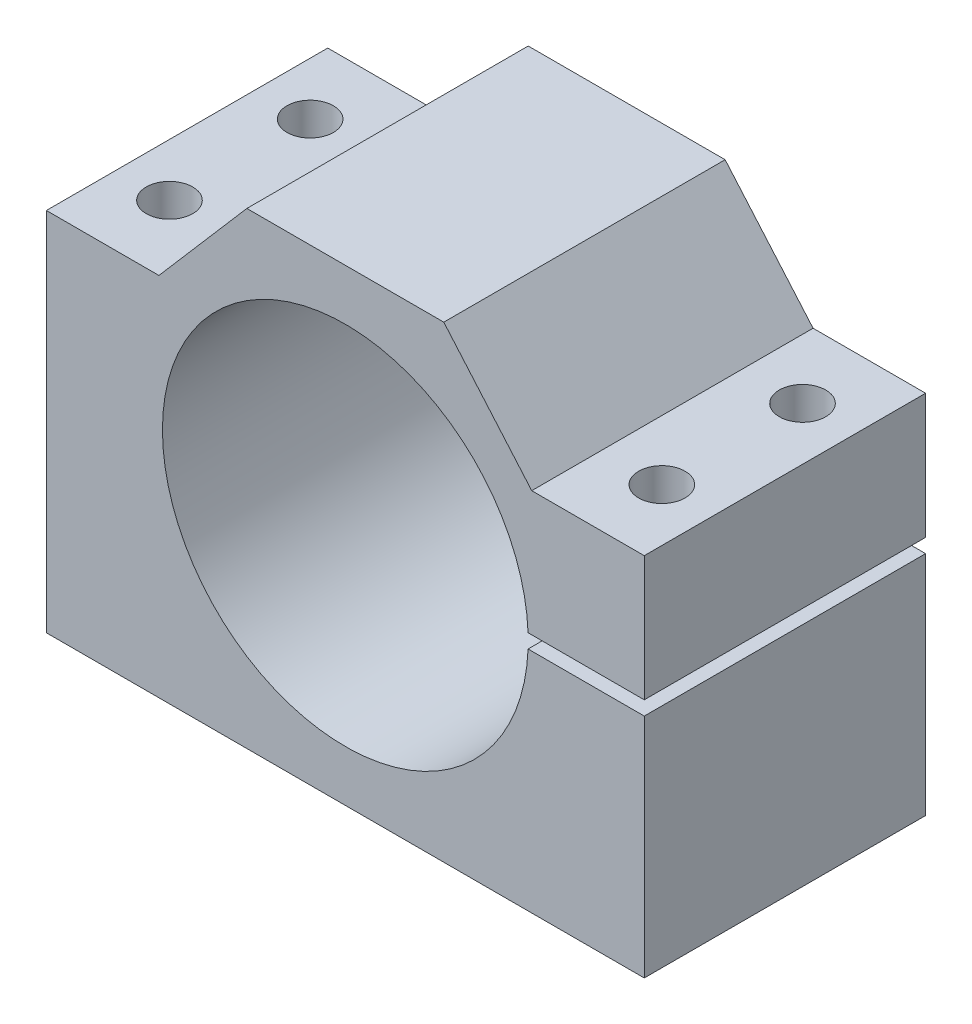
from build123d import *

# Parameters (mm, degrees)
ESQUISSE1_R             = 26
BOSS_EXTRU_1_DEPTH      = 40
ENL_V_MAT_EXTRU_1_REACH = 184.502
ESQUISSE3_R             = 3.3
ENL_V_MAT_EXTRU_2_DEPTH = 179.283669838


with BuildPart() as part:
    # Esquisse1 → Boss.-Extru.1 (new body)
    with BuildSketch(Plane.XY):
        Polygon((-165.774144338, -1.493499921), (-80.774144338, -1.493499921), (-80.774144338, 50.506500079), (-96.774144338, 50.506500079), (-109.274144338, 65.006500079), (-137.274144338, 65.006500079), (-149.774144338, 50.506500079), (-165.774144338, 50.506500079), align=None)
        with Locations((-123.274144338, 31.756500079)):
            Circle(ESQUISSE1_R, mode=Mode.SUBTRACT)
    extrude(amount=BOSS_EXTRU_1_DEPTH)

    # Esquisse2 → Enlèv. mat.-Extru.1 (cut, up to next)
    with BuildSketch(Plane.XY.offset(40), mode=Mode.PRIVATE) as enl_v_mat_extru_1_sk1:
        with BuildLine():
            Line((-97.293382224, 32.756500079), (-80.774144338, 32.756500079))
            Line((-80.774144338, 32.756500079), (-80.774144338, 30.756500079))
            Line((-80.774144338, 30.756500079), (-97.293382224, 30.756500079))
            ThreePointArc((-97.293382224, 30.756500079), (-97.274144338, 31.756500079), (-97.293382224, 32.756500079))
        make_face()
    enl_v_mat_extru_1_tool1 = extrude(enl_v_mat_extru_1_sk1.sketch, amount=-ENL_V_MAT_EXTRU_1_REACH, mode=Mode.PRIVATE) & part.part
    add(enl_v_mat_extru_1_tool1.solids().sort_by_distance((-89.027351, 31.7565, 40))[0], mode=Mode.SUBTRACT)

    # Esquisse3 → Enlèv. mat.-Extru.2 (cut, through all)
    with BuildSketch(Plane(origin=(0, 50.506500079, 0), x_dir=(1, 0, 0), z_dir=(0, 1, 0))):
        with Locations(Location((-158.274144338, -10, 0), (0, 0, 270))):
            Circle(ESQUISSE3_R)
        with Locations(Location((-158.274144338, -30, 0), (0, 0, 270))):
            Circle(ESQUISSE3_R)
        with Locations(Location((-88.274144338, -10, 0), (0, 0, 270))):
            Circle(ESQUISSE3_R)
        with Locations(Location((-88.274144338, -30, 0), (0, 0, 270))):
            Circle(ESQUISSE3_R)
    extrude(amount=-ENL_V_MAT_EXTRU_2_DEPTH, mode=Mode.SUBTRACT)


solid = part.part
